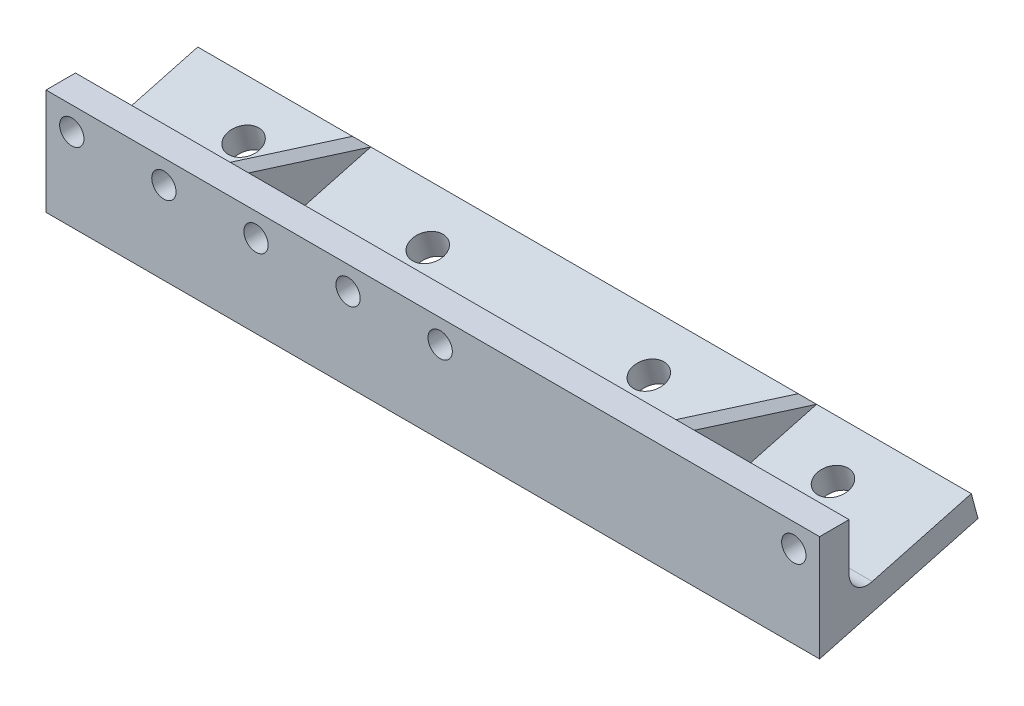
from build123d import *

# Parameters (mm, degrees)
EXTRUDE_1_DEPTH      = 30
SKETCH_2_R           = 44.45
CUT_EXTRUDE_1_DEPTH  = 4
SKETCH_3_R           = 25.5
SKETCH_3_R_2         = 2.25
CUT_EXTRUDE_2_DEPTH  = 188.619295383
CUT_EXTRUDE_3_DEPTH  = 189.215302247
SKETCH_5_R           = 1.65
CUT_EXTRUDE_4_DEPTH  = 189.215302247
EXTRUDE_START        = -30
EXTRUDE_2_DEPTH      = 30
CUT_EXTRUDE_5_DEPTH  = 198.040604952
CUT_EXTRUDE_7_DEPTH  = 233.432785983
CUT_EXTRUDE_8_DEPTH  = 233.432785983
CUT_EXTRUDE_9_DEPTH  = 233.432785983
FILLET_1_R           = 5
CUT_EXTRUDE_10_DEPTH = 233.432785983
EXTRUDE_START_2      = -5
EXTRUDE_3_DEPTH      = 5
EXTRUDE_4_DEPTH      = 5
SKETCH_14_R          = 4.25
CUT_EXTRUDE_11_DEPTH = 189.364728478
SKETCH_16_W          = 43
SKETCH_16_H          = 30
CUT_EXTRUDE_12_DEPTH = 233.432785983
EXTRUDE_7_REACH      = 188.592
SKETCH_18_W          = 210
SKETCH_18_H          = 5
EXTRUDE_8_DEPTH      = 210
EXTRUDE_9_DEPTH      = 5
EXTRUDE_10_DEPTH     = 5
SKETCH_22_R          = 4.25
CUT_EXTRUDE_13_DEPTH = 187.984035343
FILLET_2_R           = 5
CUT_EXTRUDE_14_DEPTH = 234.418610938
EXTRUDE_11_DEPTH     = 2.5
EXTRUDE_12_DEPTH     = 2.5
CUT_EXTRUDE_START    = -5
CUT_EXTRUDE_15_DEPTH = 5
SKETCH_24_R          = 3.3
CUT_EXTRUDE_16_DEPTH = 165.58736282
CUT_EXTRUDE_17_DEPTH = 5


with BuildPart() as part:
    # 草图1 → 凸台-拉伸1 (new body)
    with BuildSketch(Plane(origin=(0, 0, 0), x_dir=(1, 0, 0), z_dir=(0, 1, 0))):
        with BuildLine():
            Line((170, 31.93), (170, -31.93))
            ThreePointArc((170, -31.93), (167.781993847, -38.210172909), (162.111885646, -41.704453387))
            Line((162.111885646, -41.704453387), (15.839142344, -73.308400404))
            ThreePointArc((15.839142344, -73.308400404), (-75, 0), (15.839142344, 73.308400404))
            Line((15.839142344, 73.308400404), (162.111885646, 41.704453387))
            ThreePointArc((162.111885646, 41.704453387), (167.781993847, 38.210172909), (170, 31.93))
        make_face()
    extrude(amount=EXTRUDE_1_DEPTH)

    # 草图2 → 切除-拉伸1 (cut)
    with BuildSketch(Plane(origin=(0, 30, 0), x_dir=(1, 0, 0), z_dir=(0, 1, 0))):
        with Locations(Location((0, 0, 0), (0, 0, 270))):
            Circle(SKETCH_2_R)
    extrude(amount=-CUT_EXTRUDE_1_DEPTH, mode=Mode.SUBTRACT)

    # 草图3 → 切除-拉伸2 (cut, through all)
    with BuildSketch(Plane(origin=(0, 26, 0), x_dir=(1, 0, 0), z_dir=(0, 1, 0))):
        with Locations(Location((0, 0, 0), (0, 0, 270))):
            Circle(SKETCH_3_R)
        with Locations(Location((0, 41, 0), (0, 0, 270))):
            Circle(SKETCH_3_R_2)
        with Locations(Location((28.991378029, 28.991378029, 0), (0, 0, 270))):
            Circle(SKETCH_3_R_2)
        with Locations(Location((41, 0, 0), (0, 0, 270))):
            Circle(SKETCH_3_R_2)
        with Locations(Location((28.991378029, -28.991378029, 0), (0, 0, 270))):
            Circle(SKETCH_3_R_2)
        with Locations(Location((0, -41, 0), (0, 0, 270))):
            Circle(SKETCH_3_R_2)
        with Locations(Location((-28.991378029, -28.991378029, 0), (0, 0, 270))):
            Circle(SKETCH_3_R_2)
        with Locations(Location((-41, 0, 0), (0, 0, 270))):
            Circle(SKETCH_3_R_2)
        with Locations(Location((-28.991378029, 28.991378029, 0), (0, 0, 270))):
            Circle(SKETCH_3_R_2)
    extrude(amount=-CUT_EXTRUDE_2_DEPTH, mode=Mode.SUBTRACT)

    # 草图4 → 切除-拉伸3 (cut, through all)
    with BuildSketch(Plane(origin=(0, 30, 0), x_dir=(1, 0, 0), z_dir=(0, 1, 0))):
        with BuildLine():
            Line((124, 18.5), (134, 18.5))
            ThreePointArc((134, 18.5), (152.5, 0), (134, -18.5))
            Line((134, -18.5), (124, -18.5))
            ThreePointArc((124, -18.5), (105.5, 0), (124, 18.5))
        make_face()
    extrude(amount=-CUT_EXTRUDE_3_DEPTH, mode=Mode.SUBTRACT)

    # 草图5 → 切除-拉伸4 (cut, through all)
    with BuildSketch(Plane(origin=(0, 30, 0), x_dir=(1, 0, 0), z_dir=(0, 1, 0))):
        with Locations(Location((116.75, 25.5, 0), (0, 0, 270))):
            Circle(SKETCH_5_R)
        with Locations(Location((141.25, 25.5, 0), (0, 0, 270))):
            Circle(SKETCH_5_R)
        with Locations(Location((141.25, -25.5, 0), (0, 0, 270))):
            Circle(SKETCH_5_R)
        with Locations(Location((116.75, -25.5, 0), (0, 0, 270))):
            Circle(SKETCH_5_R)
    extrude(amount=-CUT_EXTRUDE_4_DEPTH, mode=Mode.SUBTRACT)

    # 草图6 → 凸台-拉伸2 (add)
    with BuildSketch(Plane(origin=(0, 30, 0), x_dir=(1, 0, 0), z_dir=(0, 1, 0)).offset(EXTRUDE_START)):
        with BuildLine():
            Line((158, 95), (-52, 95))
            Line((-52, 95), (-52, 54.046276467))
            ThreePointArc((-52, 54.046276467), (-20.48558667, 72.148047366), (15.839142344, 73.308400404))
            Line((15.839142344, 73.308400404), (158, 42.592874655))
            Line((158, 42.592874655), (158, 95))
        make_face()
        with BuildLine():
            ThreePointArc((15.839142344, -73.308400404), (-20.48558667, -72.148047366), (-52, -54.046276467))
            Line((-52, -54.046276467), (-52, -95))
            Line((-52, -95), (158, -95))
            Line((158, -95), (158, -42.592874655))
            Line((158, -42.592874655), (15.839142344, -73.308400404))
        make_face()
    extrude(amount=EXTRUDE_2_DEPTH)

    # 草图7 → 切除-拉伸5 (cut, through all)
    with BuildSketch(Plane(origin=(0, 30, 0), x_dir=(1, 0, 0), z_dir=(0, 1, 0))):
        with BuildLine():
            Line((-52, 54.046276467), (-52, -54.046276467))
            ThreePointArc((-52, -54.046276467), (-75, 0), (-52, 54.046276467))
        make_face()
        with BuildLine():
            Line((158, 42.592874655), (158, -42.592874655))
            Line((158, -42.592874655), (162.111885646, -41.704453387))
            ThreePointArc((162.111885646, -41.704453387), (167.781993847, -38.210172909), (170, -31.93))
            Line((170, -31.93), (170, 31.93))
            ThreePointArc((170, 31.93), (167.781993847, 38.210172909), (162.111885646, 41.704453387))
            Line((162.111885646, 41.704453387), (158, 42.592874655))
        make_face()
    extrude(amount=-CUT_EXTRUDE_5_DEPTH, mode=Mode.SUBTRACT)

    # 草图9 → 切除-拉伸7 (cut, through all)
    with BuildSketch(Plane.ZY.offset(52)):
        Polygon((-95, 20), (-60, 10.621778265), (-60, 30), (-95, 30), align=None)
    extrude(amount=-CUT_EXTRUDE_7_DEPTH, mode=Mode.SUBTRACT)

    # 草图10 → 切除-拉伸8 (cut, through all)
    with BuildSketch(Plane.ZY.offset(52)):
        Polygon((-95, 12.753066737), (-52, 1.231251463), (-52, 0), (-95, 0), align=None)
    extrude(amount=-CUT_EXTRUDE_8_DEPTH, mode=Mode.SUBTRACT)

    # 草图8 → 切除-拉伸9 (cut, through all)
    with BuildSketch(Plane.ZY.offset(52)):
        Polygon((0, 0), (52, 0), (52, 17.3), (-52, 17.3), (-52, 0), align=None)
    extrude(amount=-CUT_EXTRUDE_9_DEPTH, mode=Mode.SUBTRACT)

    # 圆角1
    fillet_1_edges = [part.edges().sort_by_distance(p)[0] for p in [
        (53, 10.621778265, -60),
    ]]
    fillet(fillet_1_edges, radius=FILLET_1_R)

    # 草图11 → 切除-拉伸10 (cut, through all)
    with BuildSketch(Plane.ZY.offset(52)):
        Polygon((-95, 12.753066737), (-93.188266684, 19.514547521), (-95, 20), align=None)
    extrude(amount=-CUT_EXTRUDE_10_DEPTH, mode=Mode.SUBTRACT)

    # 草图12 → 凸台-拉伸3 (add)
    with BuildSketch(Plane.ZY.offset(52).offset(EXTRUDE_START_2)):
        with BuildLine():
            Line((-93.188266684, 19.514547521), (-60, 30))
            Line((-60, 30), (-60, 17.137905129))
            ThreePointArc((-60, 17.137905129), (-61.956192855, 13.171138428), (-66.294095226, 12.308275998))
            Line((-66.294095226, 12.308275998), (-93.188266684, 19.514547521))
        make_face()
    extrude(amount=EXTRUDE_3_DEPTH)

    # 草图13 → 凸台-拉伸4 (add)
    with BuildSketch(Plane(origin=(158, 0, 0), x_dir=(0, 0, -1), z_dir=(1, 0, 0))):
        with BuildLine():
            Line((66.294095226, 12.308275998), (93.188266684, 19.514547521))
            Line((93.188266684, 19.514547521), (60, 30))
            Line((60, 30), (60, 17.137905129))
            ThreePointArc((60, 17.137905129), (61.956192855, 13.171138428), (66.294095226, 12.308275998))
        make_face()
    extrude(amount=-EXTRUDE_4_DEPTH)

    # 草图14 → 切除-拉伸11 (cut, through all)
    with BuildSketch(Plane(origin=(0, -5.089745962, -1.36379332), x_dir=(1, 0, 0), z_dir=(0, 0.9659258262890681, 0.2588190451025214))):
        with Locations(Location((-27, 82.063690052, 0), (0, 0, 270))):
            Circle(SKETCH_14_R)
        with Locations(Location((23, 82.063690052, 0), (0, 0, 270))):
            Circle(SKETCH_14_R)
        with Locations(Location((83, 82.063690052, 0), (0, 0, 270))):
            Circle(SKETCH_14_R)
        with Locations(Location((133, 82.063690052, 0), (0, 0, 270))):
            Circle(SKETCH_14_R)
    extrude(amount=-CUT_EXTRUDE_11_DEPTH, mode=Mode.SUBTRACT)

    # 草图16 → 切除-拉伸12 (cut, through all)
    with BuildSketch(Plane.ZY.offset(52)):
        with Locations((73.5, 15)):
            Rectangle(SKETCH_16_W, SKETCH_16_H)
    extrude(amount=-CUT_EXTRUDE_12_DEPTH, mode=Mode.SUBTRACT)

    # 凸台-拉伸7: up to this plane
    extrude_7_end = Plane(origin=(0, -11.851226746, -3.175526636), z_dir=(0, -0.9659258262890681, -0.25881904510252146))
    # 草图18 → 凸台-拉伸7 (add, up to the surface)
    with BuildSketch(Plane(origin=(0, 30, 0), x_dir=(1, 0, 0), z_dir=(0, 1, 0)), mode=Mode.PRIVATE) as extrude_7_sk1:
        with Locations((53, -54.5)):
            Rectangle(SKETCH_18_W, SKETCH_18_H)
    extrude_7_tool1 = split(extrude(extrude_7_sk1.sketch, amount=-EXTRUDE_7_REACH, mode=Mode.PRIVATE), bisect_by=extrude_7_end, keep=Keep.BOTH, mode=Mode.PRIVATE)
    add(extrude_7_tool1.solids().sort_by_distance((53, 30, 54.5))[0])

    # 草图19 → 凸台-拉伸8 (add)
    with BuildSketch(Plane.ZY.offset(52)):
        Polygon((57, -27.975210512), (90.188266684, -36.867979769), (92, -30.106498985), (57, -20.72827725), align=None)
    extrude(amount=-EXTRUDE_8_DEPTH)

    # 草图20 → 凸台-拉伸9 (add)
    with BuildSketch(Plane.ZY.offset(52)):
        Polygon((92, -30.106498985), (57, -20.72827725), (57, 30), align=None)
    extrude(amount=-EXTRUDE_9_DEPTH)

    # 草图21 → 凸台-拉伸10 (add)
    with BuildSketch(Plane(origin=(158, 0, 0), x_dir=(0, 0, -1), z_dir=(1, 0, 0))):
        Polygon((-57, 30), (-92, -30.106498985), (-57, -20.72827725), align=None)
    extrude(amount=-EXTRUDE_10_DEPTH)

    # 草图22 → 切除-拉伸13 (cut, through all)
    with BuildSketch(Plane(origin=(0, -5.089745962, -1.36379332), x_dir=(1, 0, 0), z_dir=(0, 0.9659258262890686, 0.25881904510251946))):
        with Locations(Location((-27, -77.936309948, 0), (0, 0, 270))):
            Circle(SKETCH_22_R)
        with Locations(Location((23, -69.936309948, 0), (0, 0, 270))):
            Circle(SKETCH_22_R)
        with Locations(Location((83, -69.936309948, 0), (0, 0, 270))):
            Circle(SKETCH_22_R)
        with Locations(Location((133, -77.936309948, 0), (0, 0, 270))):
            Circle(SKETCH_22_R)
    extrude(amount=-CUT_EXTRUDE_13_DEPTH, mode=Mode.SUBTRACT)

    # 圆角2
    fillet_2_edges = [part.edges().sort_by_distance(p)[0] for p in [
        (53, -20.72827725, 57),
    ]]
    fillet(fillet_2_edges, radius=FILLET_2_R)

    # 草图23 → 切除-拉伸14 (cut, through all)
    with BuildSketch(Plane.ZY.offset(52)):
        Polygon((-52, 17.3), (-52, 40.52409207), (98.672945053, 40.52409207), (98.672945053, -43.91232927), (-52, -43.91232927), align=None)
    extrude(amount=-CUT_EXTRUDE_14_DEPTH, mode=Mode.SUBTRACT)

    # 草图25 → 凸台-拉伸11 (add, symmetric)
    with BuildSketch(Plane.ZY.offset(7.5)):
        with BuildLine():
            Line((-93.188266684, 19.514547521), (-66.294095226, 12.308275998))
            ThreePointArc((-66.294095226, 12.308275998), (-61.956192855, 13.171138428), (-60, 17.137905129))
            Line((-60, 17.137905129), (-60, 30))
            Line((-60, 30), (-93.188266684, 19.514547521))
        make_face()
    extrude(amount=EXTRUDE_11_DEPTH, both=True)

    # 草图26 → 凸台-拉伸12 (add, symmetric)
    with BuildSketch(Plane(origin=(113.5, 0, 0), x_dir=(0, 0, -1), z_dir=(1, 0, 0))):
        with BuildLine():
            Line((60, 30), (60, 17.137905129))
            ThreePointArc((60, 17.137905129), (61.956192855, 13.171138428), (66.294095226, 12.308275998))
            Line((66.294095226, 12.308275998), (93.188266684, 19.514547521))
            Line((93.188266684, 19.514547521), (60, 30))
        make_face()
    extrude(amount=EXTRUDE_12_DEPTH, both=True)

    # 草图27 → 切除-拉伸15 (cut)
    with BuildSketch(Plane.ZY.offset(-153).offset(CUT_EXTRUDE_START)):
        with BuildLine():
            Line((-60, 17.137905129), (-60, 30))
            Line((-60, 30), (-93.188266684, 19.514547521))
            Line((-93.188266684, 19.514547521), (-66.294095226, 12.308275998))
            ThreePointArc((-66.294095226, 12.308275998), (-61.956192855, 13.171138428), (-60, 17.137905129))
        make_face()
    extrude(amount=CUT_EXTRUDE_15_DEPTH, mode=Mode.SUBTRACT)

    # 草图24 → 切除-拉伸16 (cut, through all)
    with BuildSketch(Plane(origin=(0, 0, -60), x_dir=(-1, 0, 0), z_dir=(0, 0, -1))):
        with Locations((-151, 23.65)):
            Circle(SKETCH_24_R)
        with Locations((45, 23.65)):
            Circle(SKETCH_24_R)
        with Locations((20, 23.65)):
            Circle(SKETCH_24_R)
        with Locations((-5, 23.65)):
            Circle(SKETCH_24_R)
        with Locations((-30, 23.65)):
            Circle(SKETCH_24_R)
        with Locations((-55, 23.65)):
            Circle(SKETCH_24_R)
    extrude(amount=-CUT_EXTRUDE_16_DEPTH, mode=Mode.SUBTRACT)

    # 草图28 → 切除-拉伸17 (cut)
    with BuildSketch(Plane(origin=(-47, 0, 0), x_dir=(0, 0, -1), z_dir=(1, 0, 0))):
        with BuildLine():
            Line((66.294095226, 12.308275998), (93.188266684, 19.514547521))
            Line((93.188266684, 19.514547521), (60, 30))
            Line((60, 30), (60, 26.27488095))
            Line((60, 26.27488095), (60, 21.02511905))
            Line((60, 21.02511905), (60, 17.137905129))
            ThreePointArc((60, 17.137905129), (61.956192855, 13.171138428), (66.294095226, 12.308275998))
        make_face()
    extrude(amount=-CUT_EXTRUDE_17_DEPTH, mode=Mode.SUBTRACT)


solid = part.part
